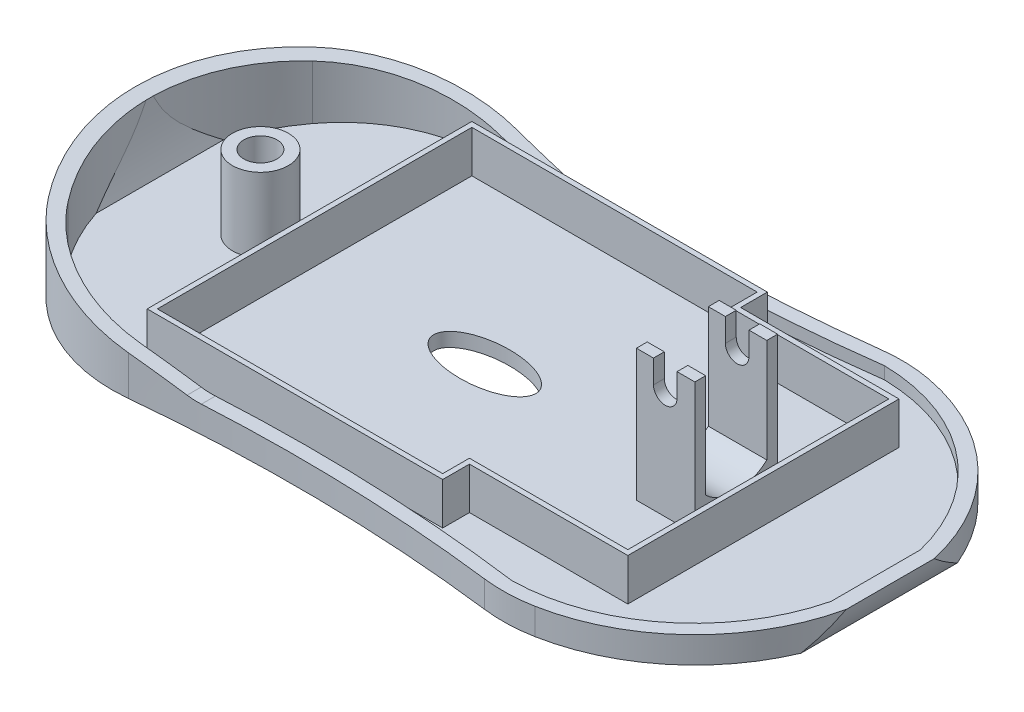
from build123d import *

# Parameters (mm, degrees)
SKETCH1_W           = 119.3
SKETCH1_H           = 12.57
BOSS_EXTRUDE1_DEPTH = 62.92
CUT_EXTRUDE1_DEPTH  = 136.460035804
SKETCH3_OUTSIDE_W   = 148.392
SKETCH3_OUTSIDE_H   = 92.012
CUT_EXTRUDE2_DEPTH  = 136.460035948
CUT_EXTRUDE3_DEPTH  = 150.114519226
FILLET2_R           = 25
SHELL1_T            = -2.2
FILLET3_R           = 25
SKETCH5_R           = 4.4
SKETCH5_R_2         = 2.61
BOSS_EXTRUDE2_DEPTH = 11.6
SKETCH6_W           = 9.18
SKETCH6_H           = 13
BOSS_EXTRUDE3_DEPTH = 20.68
CUT_EXTRUDE4_DEPTH  = 13
CUT_EXTRUDE5_REACH  = 117.701
SKETCH9_RX          = 8.015
SKETCH9_RY          = 3.9
CUT_EXTRUDE6_DEPTH  = 2.2
BOSS_EXTRUDE4_DEPTH = 6.6


with BuildPart() as part:
    # Sketch1 → Boss-Extrude1 (new body)
    with BuildSketch(Plane.XY):
        with Locations((59.65, 6.285)):
            Rectangle(SKETCH1_W, SKETCH1_H)
    extrude(amount=-BOSS_EXTRUDE1_DEPTH)

    # Sketch2 → Cut-Extrude1 (cut, through all)
    with BuildSketch(Plane.XY):
        with BuildLine():
            Line((2.5, 0), (0, 0))
            Line((0, 0), (0, 12.57))
            add(Edge.make_bspline(
                [(0, 12.57), (0.043845712, 8.081625628), (0.108959078, 3.922529992), (2.5, 0)],
                knots=[0, 0, 0, 0, 1, 1, 1, 1], degree=3))
        make_face()
        with BuildLine():
            Line((116.8, 0), (119.3, 0))
            Line((119.3, 0), (119.3, 12.57))
            add(Edge.make_bspline(
                [(119.3, 12.57), (119.27645764, 8.088301082), (119.176818262, 3.920281767), (116.8, 0)],
                knots=[0, 0, 0, 0, 1, 1, 1, 1], degree=3))
        make_face()
    extrude(amount=-CUT_EXTRUDE1_DEPTH, mode=Mode.SUBTRACT)

    # Sketch3 outside → Cut-Extrude2 (cut, through all)
    with BuildSketch(Plane(origin=(0, 12.57, 0), x_dir=(1, 0, 0), z_dir=(0, 1, 0))):
        with Locations((59.65, 31.46)):
            Rectangle(SKETCH3_OUTSIDE_W, SKETCH3_OUTSIDE_H)
        with BuildLine():
            ThreePointArc((20.6, 62.92), (0, 31.46), (20.6, 0))
            ThreePointArc((20.6, 0), (54.44, 2.24), (88.28, 0))
            ThreePointArc((88.28, 0), (119.3, 31.46), (88.28, 62.92))
            ThreePointArc((88.28, 62.92), (54.44, 60.68), (20.6, 62.92))
        make_face(mode=Mode.SUBTRACT)
    extrude(amount=-CUT_EXTRUDE2_DEPTH, mode=Mode.SUBTRACT)

    # Sketch4 → Cut-Extrude3 (cut, through all)
    with BuildSketch(Plane.XY.offset(25.65)):
        with BuildLine():
            Line((0, 12.57), (37.841472348, 4.366984059))
            ThreePointArc((37.841472348, 4.366984059), (38.894673621, 4.19690794), (39.96, 4.14))
            Line((39.96, 4.14), (135.606002682, 4.14))
            Line((135.606002682, 4.14), (135.606002682, 12.57))
            Line((135.606002682, 12.57), (0, 12.57))
        make_face()
    extrude(amount=-CUT_EXTRUDE3_DEPTH, mode=Mode.SUBTRACT)

    # Fillet2
    fillet2_edges = [part.edges().sort_by_distance(p)[0] for p in [
        (20.6, 4.052236343, -62.92),
        (20.6, 4.052236343, 0),
    ]]
    fillet(fillet2_edges, radius=FILLET2_R)

    # Shell1
    shell1_openings = [part.faces().sort_by_distance(p)[0] for p in [
        (77.148213314, 4.14, -31.46),
        (38.894673621, 4.19690794, -31.46),
        (21.161073272, 7.982847053, -31.46),
    ]]
    offset(amount=SHELL1_T, openings=shell1_openings)

    # Fillet3
    fillet3_edges = [part.edges().sort_by_distance(p)[0] for p in [
        (88.28, 2.07, 0),
        (88.28, 2.07, -62.92),
    ]]
    fillet(fillet3_edges, radius=FILLET3_R)

    # Sketch5 → Boss-Extrude2 (add)
    with BuildSketch(Plane(origin=(0, 2.2, 0), x_dir=(1, 0, 0), z_dir=(0, 1, 0))):
        with Locations(Location((19.604995827, 31.46, 0), (0, 0, 90))):
            Circle(SKETCH5_R)
        with Locations(Location((19.604995827, 31.46, 0), (0, 0, 270))):
            Circle(SKETCH5_R_2, mode=Mode.SUBTRACT)
    extrude(amount=BOSS_EXTRUDE2_DEPTH)

    # Sketch6 → Boss-Extrude3 (add)
    with BuildSketch(Plane(origin=(0, 2.2, 0), x_dir=(1, 0, 0), z_dir=(0, 1, 0))):
        with Locations((89.845009818, 31.371696647)):
            Rectangle(SKETCH6_W, SKETCH6_H)
    extrude(amount=BOSS_EXTRUDE3_DEPTH)

    # Sketch7 → Cut-Extrude4 (cut)
    with BuildSketch(Plane.XY.offset(-24.871696647)):
        with BuildLine():
            Line((87.935009818, 22.88), (91.635009818, 22.88))
            Line((91.635009818, 22.88), (91.635009818, 19.23))
            ThreePointArc((91.635009818, 19.23), (89.785009818, 17.38), (87.935009818, 19.23))
            Line((87.935009818, 19.23), (87.935009818, 22.88))
        make_face()
    extrude(amount=-CUT_EXTRUDE4_DEPTH, mode=Mode.SUBTRACT)

    # Cut-Extrude5: up to this face of the body (flat: up to its plane)
    cut_extrude5_end = Plane(part.part.faces().sort_by_distance((85.255009818, 12.54, -31.371696647))[0])
    # Sketch8 → Cut-Extrude5 (cut, up to the picked face)
    with BuildSketch(Plane(origin=(94.435009818, 0, 0), x_dir=(0, 0, -1), z_dir=(1, 0, 0)), mode=Mode.PRIVATE) as cut_extrude5_sk1:
        with BuildLine():
            Line((26.571696647, 22.88), (36.171696647, 22.88))
            Line((36.171696647, 22.88), (36.171696647, 6.617757827))
            ThreePointArc((36.171696647, 6.617757827), (31.371696647, 4.705064996), (26.571696647, 6.617757827))
            Line((26.571696647, 6.617757827), (26.571696647, 22.88))
        make_face()
    cut_extrude5_tool1 = split(extrude(cut_extrude5_sk1.sketch, amount=-CUT_EXTRUDE5_REACH, mode=Mode.PRIVATE), bisect_by=cut_extrude5_end, keep=Keep.BOTH, mode=Mode.PRIVATE)
    add(cut_extrude5_tool1.solids().sort_by(Axis((94.43501, 14.082718, -31.371697), (-1, 0, 0)))[0], mode=Mode.SUBTRACT)

    # Sketch9 → Cut-Extrude6 (cut)
    with BuildSketch(Plane(origin=(0, 2.2, 0), x_dir=(1, 0, 0), z_dir=(0, 1, 0))):
        with Locations((54.82980624, 31.48)):
            Ellipse(SKETCH9_RX, SKETCH9_RY)
    extrude(amount=-CUT_EXTRUDE6_DEPTH, mode=Mode.SUBTRACT)

    # Sketch10 → Boss-Extrude4 (add)
    with BuildSketch(Plane(origin=(0, 2.2, 0), x_dir=(1, 0, 0), z_dir=(0, 1, 0))):
        Polygon((73.82480624, 56.871696647), (73.82480624, 52.671696647), (98.70480624, 52.671696647), (98.70480624, 10.071696647), (73.82480624, 10.071696647), (73.82480624, 5.871696647), (27.40480624, 5.871696647), (27.40480624, 56.871696647), align=None)
        Polygon((28.20480624, 56.071696647), (73.02480624, 56.071696647), (73.02480624, 51.871696647), (97.90480624, 51.871696647), (97.90480624, 10.871696647), (73.02480624, 10.871696647), (73.02480624, 6.671696647), (28.20480624, 6.671696647), align=None, mode=Mode.SUBTRACT)
    extrude(amount=BOSS_EXTRUDE4_DEPTH)


solid = part.part
